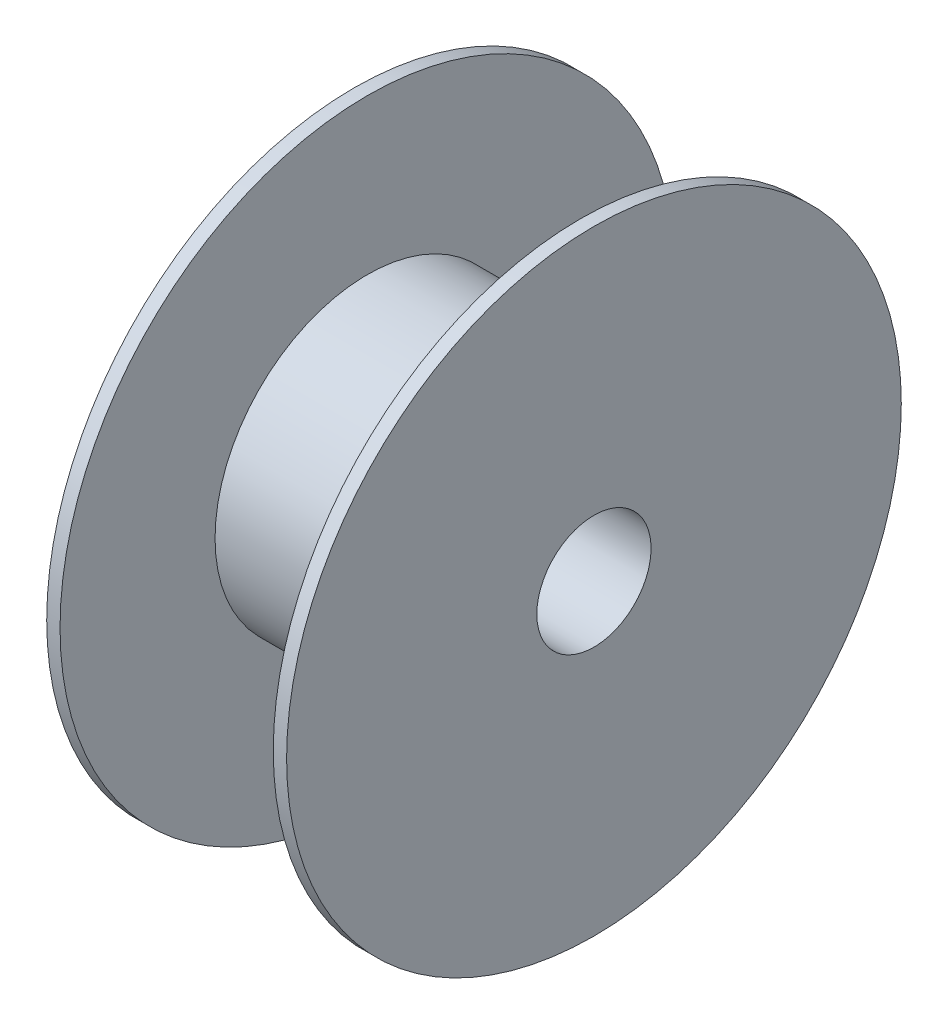
from build123d import *


with BuildPart() as part:
    # Sketch1 → Revolve1 (revolve)
    with BuildSketch(Plane.XY, mode=Mode.PRIVATE) as revolve1_sk:
        Polygon((80, 19.05), (0, 19.05), (0, 102.5), (4.445, 102.5), (4.445, 50.8), (75.555, 50.8), (75.555, 102.5), (80, 102.5), align=None)
    revolve(revolve1_sk.sketch.rotate(Axis((0, 0, 0), (1, 0, 0)), 90), axis=Axis((0, 0, 0), (1, 0, 0)))


solid = part.part
